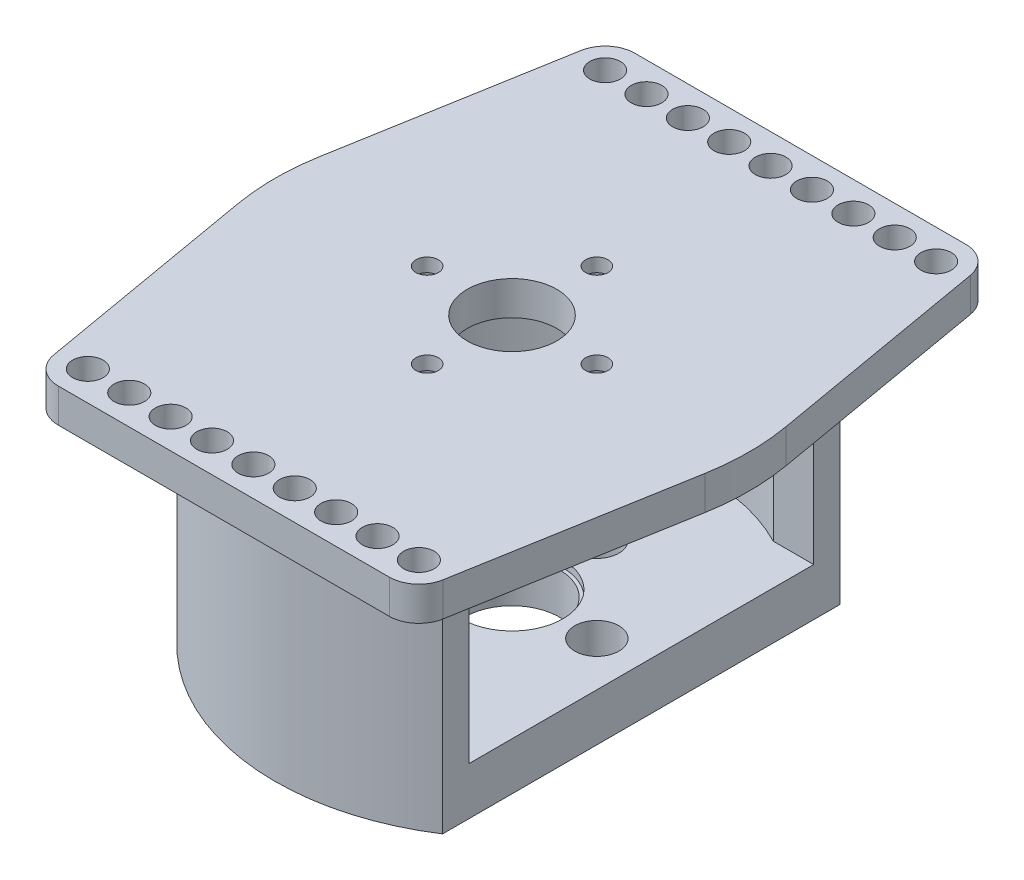
from build123d import *

# Parameters (mm, degrees)
SKETCH1_R                      = 34.925
SKETCH1_R_2                    = 7
BOSS_EXTRUDE1_DEPTH            = 7.032
SKETCH2_R                      = 7.5
CUT_EXTRUDE1_DEPTH             = 1
BOSS_EXTRUDE2_DEPTH            = 30
CUT_EXTRUDE2_DEPTH             = 58.78850448
SKETCH6_R                      = 34.925
SKETCH6_R_2                    = 6.6
BOSS_EXTRUDE6_DEPTH            = 5
CBORE_FOR_M3_SHCS1_D           = 3.3
CBORE_FOR_M3_SHCS1_DEPTH       = 5
CBORE_FOR_M3_SHCS1_CBORE_D     = 6.5
CBORE_FOR_M3_SHCS1_CBORE_DEPTH = 3
SKETCH9_R                      = 3.25
CUT_EXTRUDE3_DEPTH             = 62.732327625
SKETCH10_R                     = 2.2479
BOSS_EXTRUDE7_DEPTH            = 5


with BuildPart() as part:
    # Sketch1 → Boss-Extrude1 (new body)
    with BuildSketch(Plane(origin=(0, 0, 0), x_dir=(1, 0, 0), z_dir=(0, 1, 0))):
        with Locations(Location((0, 0, 0), (0, 0, 270))):
            Circle(SKETCH1_R)
        with Locations(Location((0, 0, 0), (0, 0, 270))):
            Circle(SKETCH1_R_2, mode=Mode.SUBTRACT)
    extrude(amount=BOSS_EXTRUDE1_DEPTH)

    # Sketch2 → Cut-Extrude1 (cut)
    with BuildSketch(Plane(origin=(0, 7.032, 0), x_dir=(1, 0, 0), z_dir=(0, 1, 0))):
        with Locations(Location((0, 0, 0), (0, 0, 270))):
            Circle(SKETCH2_R)
    extrude(amount=-CUT_EXTRUDE1_DEPTH, mode=Mode.SUBTRACT)

    # Sketch3 → Boss-Extrude2 (add)
    with BuildSketch(Plane(origin=(0, 7.032, 0), x_dir=(1, 0, 0), z_dir=(0, 1, 0))):
        with BuildLine():
            Line((19.05, 25.4), (19.05, 29.272053652))
            ThreePointArc((19.05, 29.272053652), (-34.925, 0), (19.05, -29.272053652))
            Line((19.05, -29.272053652), (19.05, -25.4))
            Line((19.05, -25.4), (13.090860361, -25.4))
            ThreePointArc((13.090860361, -25.4), (-28.575, 0), (13.090860361, 25.4))
            Line((13.090860361, 25.4), (19.05, 25.4))
        make_face()
    extrude(amount=BOSS_EXTRUDE2_DEPTH)

    # Sketch3<3> → Cut-Extrude2 (cut, through all)
    with BuildSketch(Plane(origin=(0, 7.032, 0), x_dir=(1, 0, 0), z_dir=(0, 1, 0))):
        with BuildLine():
            ThreePointArc((19.05, -29.272053652), (34.925, 0), (19.05, 29.272053652))
            Line((19.05, 29.272053652), (19.05, 25.4))
            Line((19.05, 25.4), (19.05, -25.4))
            Line((19.05, -25.4), (19.05, -29.272053652))
        make_face()
    extrude(amount=-CUT_EXTRUDE2_DEPTH, mode=Mode.SUBTRACT)

    # Sketch6 → Boss-Extrude6 (add)
    with BuildSketch(Plane(origin=(0, 37.032, 0), x_dir=(1, 0, 0), z_dir=(0, 1, 0))):
        with Locations(Location((0, 0, 0), (0, 0, 56.944268849))):
            Circle(SKETCH6_R)
        with Locations(Location((0, 0, 0), (0, 0, 270))):
            Circle(SKETCH6_R_2, mode=Mode.SUBTRACT)
    extrude(amount=BOSS_EXTRUDE6_DEPTH)

    # CBORE for M3 SHCS1
    with Locations(Plane(origin=(0, 37.032, 0), x_dir=(-1, 0, 0), z_dir=(0, -1, 0))):
        with Locations((-12.5, 0), (0, -12.5), (0, 12.5), (12.5, 0)):
            CounterBoreHole(CBORE_FOR_M3_SHCS1_D / 2, CBORE_FOR_M3_SHCS1_CBORE_D / 2, CBORE_FOR_M3_SHCS1_CBORE_DEPTH, depth=CBORE_FOR_M3_SHCS1_DEPTH)

    # Sketch9 → Cut-Extrude3 (cut, through all)
    with BuildSketch(Plane.XZ.offset(-37.032)):
        with Locations(Location((0, 12.5, 0), (0, 0, 270))):
            Circle(SKETCH9_R)
        with Locations(Location((12.5, 0, 0), (0, 0, 270))):
            Circle(SKETCH9_R)
        with Locations(Location((0, -12.5, 0), (0, 0, 270))):
            Circle(SKETCH9_R)
        with Locations(Location((-12.5, 0, 0), (0, 0, 270))):
            Circle(SKETCH9_R)
    extrude(amount=CUT_EXTRUDE3_DEPTH, mode=Mode.SUBTRACT)

    # Sketch10 → Boss-Extrude7 (add)
    with BuildSketch(Plane(origin=(0, 42.032, 0), x_dir=(1, 0, 0), z_dir=(0, 1, 0))):
        with BuildLine():
            Line((-28.684888393, 38.84902648), (-34.407107147, 5.992211842))
            Line((-34.407107147, 5.992211842), (0, 34.925))
            Line((0, 34.925), (34.407107147, 5.992211842))
            Line((34.407107147, 5.992211842), (28.684888393, 38.84902648))
            ThreePointArc((28.684888393, 38.84902648), (27.193689744, 41.44130591), (24.384, 42.465625))
            Line((24.384, 42.465625), (-24.384, 42.465625))
            ThreePointArc((-24.384, 42.465625), (-27.193689744, 41.44130591), (-28.684888393, 38.84902648))
        make_face()
        with Locations(Location((-24.384, 38.1, 0), (0, 0, 270))):
            Circle(SKETCH10_R, mode=Mode.SUBTRACT)
        with Locations(Location((-18.288, 38.1, 0), (0, 0, 270))):
            Circle(SKETCH10_R, mode=Mode.SUBTRACT)
        with Locations(Location((-12.192, 38.1, 0), (0, 0, 270))):
            Circle(SKETCH10_R, mode=Mode.SUBTRACT)
        with Locations(Location((-6.096, 38.1, 0), (0, 0, 270))):
            Circle(SKETCH10_R, mode=Mode.SUBTRACT)
        with Locations(Location((0, 38.1, 0), (0, 0, 270))):
            Circle(SKETCH10_R, mode=Mode.SUBTRACT)
        with Locations(Location((6.096, 38.1, 0), (0, 0, 270))):
            Circle(SKETCH10_R, mode=Mode.SUBTRACT)
        with Locations(Location((12.192, 38.1, 0), (0, 0, 270))):
            Circle(SKETCH10_R, mode=Mode.SUBTRACT)
        with Locations(Location((18.288, 38.1, 0), (0, 0, 270))):
            Circle(SKETCH10_R, mode=Mode.SUBTRACT)
        with Locations(Location((24.384, 38.1, 0), (0, 0, 270))):
            Circle(SKETCH10_R, mode=Mode.SUBTRACT)
    boss_extrude7 = extrude(amount=-BOSS_EXTRUDE7_DEPTH)

    # Mirror1: Boss-Extrude7 across plane
    add(boss_extrude7.mirror(Plane.XY))


solid = part.part
